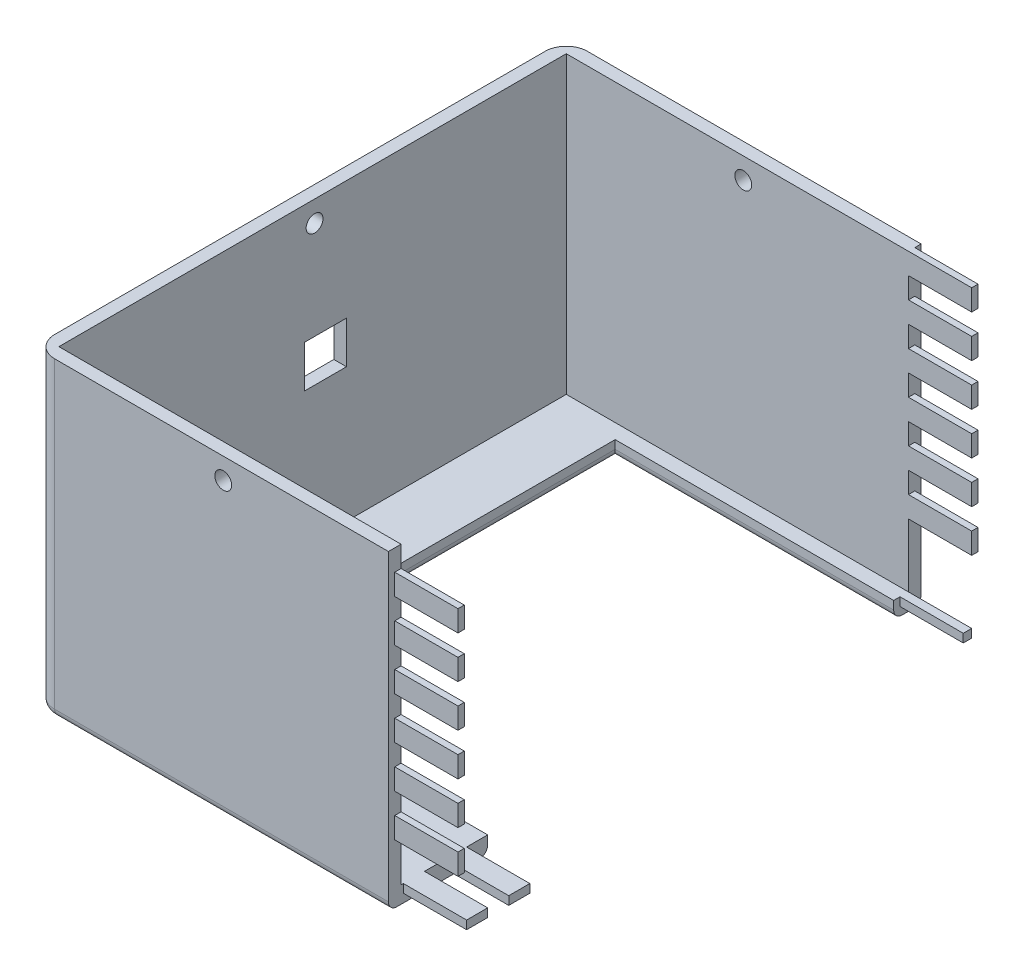
from build123d import *

# Parameters (mm, degrees)
SKETCH1_W               = 168.379590863
SKETCH1_H               = 126.39
BOSS_EXTRUDE1_DEPTH     = 70
SKETCH2_W               = 168.379590863
SKETCH2_H               = 126.39
BOSS_EXTRUDE2_DEPTH     = 4
SKETCH3_W               = 142.779590863
SKETCH3_H               = 96.34
CUT_EXTRUDE1_DEPTH      = 4
FILLET1_R               = 5
FILLET4_R               = 2
FILLET5_R               = 2
SKETCH4_W               = 10
SKETCH4_H               = 10
CUT_EXTRUDE2_DEPTH      = 195
SKETCH6_R               = 2
CUT_EXTRUDE3_DEPTH      = 195
SKETCH8_R               = 2
CUT_EXTRUDE4_DEPTH      = 195
CUT_EXTRUDE5_DEPTH      = 134.542245944
CUT_EXTRUDE5_DEPTH_BACK = 134.542245944
SKETCH12_W              = 87.181234027
SKETCH12_H              = 80.365226026
SKETCH14_W              = 5
SKETCH14_H              = 2
BOSS_EXTRUDE4_DEPTH     = 15
SKETCH17_W              = 2
SKETCH17_H              = 2
BOSS_EXTRUDE5_DEPTH     = 15
SKETCH18_W              = 1.5
SKETCH18_H              = 5
BOSS_EXTRUDE8_DEPTH     = 15
SKETCH19_W              = 1.5
SKETCH19_H              = 5
BOSS_EXTRUDE9_DEPTH     = 15


with BuildPart() as part:
    # Sketch1 → Boss-Extrude1 (new body)
    with BuildSketch(Plane(origin=(0, 0, 0), x_dir=(1, 0, 0), z_dir=(0, 1, 0))):
        with Locations((4.455204569, -8.048213198)):
            Rectangle(SKETCH1_W, SKETCH1_H)
        Polygon((-76.734590863, 32.146786802), (-76.734590863, 52.146786802), (85.645, 52.146786802), (85.645, -68.243213198), (60.555409137, -68.243213198), (-76.734590863, -68.243213198), align=None, mode=Mode.SUBTRACT)
    extrude(amount=BOSS_EXTRUDE1_DEPTH)

    # Sketch2 → Boss-Extrude2 (add)
    with BuildSketch(Plane(origin=(0, 0, 0), x_dir=(-1, 0, 0), z_dir=(0, -1, 0))):
        with Locations((-4.455204569, -8.048213198)):
            Rectangle(SKETCH2_W, SKETCH2_H)
    extrude(amount=BOSS_EXTRUDE2_DEPTH)

    # Sketch3 → Cut-Extrude1 (cut)
    with BuildSketch(Plane(origin=(0, 0, 0), x_dir=(1, 0, 0), z_dir=(0, 1, 0))):
        with Locations((9.755204569, 0.476786802)):
            Rectangle(SKETCH3_W, SKETCH3_H)
    extrude(amount=-CUT_EXTRUDE1_DEPTH, mode=Mode.SUBTRACT)

    # Fillet1
    fillet1_edges = [part.edges().sort_by_distance(p)[0] for p in [
        (-79.734590863, 33, -55.146786802),
        (88.645, 33, -55.146786802),
        (88.645, 33, 71.243213198),
        (-79.734590863, 33, 71.243213198),
    ]]
    fillet(fillet1_edges, radius=FILLET1_R)

    # Fillet4
    fillet4_edges = [part.edges().sort_by_distance(p)[0] for p in [
        (4.455204569, -4, 71.243213198),
        (-79.734590863, -4, 8.048213198),
        (4.455204569, -4, -55.146786802),
        (88.645, -4, 8.048213198),
        (87.180533906, -4, 69.778747104),
        (87.180533906, -4, -53.682320708),
        (-78.270124769, -4, -53.682320708),
        (-78.270124769, -4, 69.778747104),
    ]]
    fillet(fillet4_edges, radius=FILLET4_R)

    # Fillet5
    fillet5_edges = [part.edges().sort_by_distance(p)[0] for p in [
        (81.145, -4, -0.476786802),
        (9.755204569, -4, 47.693213198),
        (-61.634590863, -4, -0.476786802),
        (9.755204569, -4, -48.646786802),
    ]]
    fillet(fillet5_edges, radius=FILLET5_R)

    # Sketch4 → Cut-Extrude2 (cut)
    with BuildSketch(Plane.ZY.offset(79.734590863)):
        with Locations((5.00870497, 36.749697215)):
            Rectangle(SKETCH4_W, SKETCH4_H)
    extrude(amount=-CUT_EXTRUDE2_DEPTH, mode=Mode.SUBTRACT)

    # Sketch6 → Cut-Extrude3 (cut)
    with BuildSketch(Plane(origin=(88.645, 0, 0), x_dir=(0, 0, -1), z_dir=(1, 0, 0))):
        with Locations((-7.57558331, 65)):
            Circle(SKETCH6_R)
    extrude(amount=-CUT_EXTRUDE3_DEPTH, mode=Mode.SUBTRACT)

    # Sketch8 → Cut-Extrude4 (cut)
    with BuildSketch(Plane(origin=(0, 0, -55.146786802), x_dir=(-1, 0, 0), z_dir=(0, 0, -1))):
        with Locations((-43.645, 65)):
            Circle(SKETCH8_R)
        with Locations((34.734590863, 65)):
            Circle(SKETCH8_R)
    extrude(amount=-CUT_EXTRUDE4_DEPTH, mode=Mode.SUBTRACT)

    # Sketch12 → Cut-Extrude5 (cut, two sides: drawn at the far end of the back side and taken through both)
    with BuildSketch(Plane.XY.offset(-CUT_EXTRUDE5_DEPTH_BACK)):
        with Locations((48.045821583, 29.817386987)):
            Rectangle(SKETCH12_W, SKETCH12_H)
    extrude(amount=CUT_EXTRUDE5_DEPTH + CUT_EXTRUDE5_DEPTH_BACK, mode=Mode.SUBTRACT)

    # Sketch14 → Boss-Extrude4 (add)
    with BuildSketch(Plane(origin=(4.455204569, 0, 0), x_dir=(0, 0, -1), z_dir=(1, 0, 0))):
        with Locations((-55.193213198, -1)):
            Rectangle(SKETCH14_W, SKETCH14_H)
        with Locations((-65.193213198, -1)):
            Rectangle(SKETCH14_W, SKETCH14_H)
    extrude(amount=BOSS_EXTRUDE4_DEPTH)

    # Sketch17 → Boss-Extrude5 (add)
    with BuildSketch(Plane(origin=(4.455204569, 0, 0), x_dir=(0, 0, -1), z_dir=(1, 0, 0))):
        with Locations((51.146786802, -1)):
            Rectangle(SKETCH17_W, SKETCH17_H)
    extrude(amount=BOSS_EXTRUDE5_DEPTH)

    # Sketch18 → Boss-Extrude8 (add)
    with BuildSketch(Plane(origin=(4.455204569, 0, 0), x_dir=(0, 0, -1), z_dir=(1, 0, 0))):
        with Locations((-68.993213198, 62.5)):
            Rectangle(SKETCH18_W, SKETCH18_H)
        with Locations((-68.993213198, 52.5)):
            Rectangle(SKETCH18_W, SKETCH18_H)
        with Locations((-68.993213198, 42.5)):
            Rectangle(SKETCH18_W, SKETCH18_H)
        with Locations((-68.993213198, 32.5)):
            Rectangle(SKETCH18_W, SKETCH18_H)
        with Locations((-68.993213198, 22.5)):
            Rectangle(SKETCH18_W, SKETCH18_H)
        with Locations((-68.993213198, 12.5)):
            Rectangle(SKETCH18_W, SKETCH18_H)
    extrude(amount=BOSS_EXTRUDE8_DEPTH)

    # Sketch19 → Boss-Extrude9 (add)
    with BuildSketch(Plane(origin=(4.455204569, 0, 0), x_dir=(0, 0, -1), z_dir=(1, 0, 0))):
        with Locations((52.896786802, 57.5)):
            Rectangle(SKETCH19_W, SKETCH19_H)
        with Locations((52.896786802, 67.5)):
            Rectangle(SKETCH19_W, SKETCH19_H)
        with Locations((52.896786802, 47.5)):
            Rectangle(SKETCH19_W, SKETCH19_H)
        with Locations((52.896786802, 37.5)):
            Rectangle(SKETCH19_W, SKETCH19_H)
        with Locations((52.896786802, 27.5)):
            Rectangle(SKETCH19_W, SKETCH19_H)
        with Locations((52.896786802, 17.5)):
            Rectangle(SKETCH19_W, SKETCH19_H)
    extrude(amount=BOSS_EXTRUDE9_DEPTH)


solid = part.part
